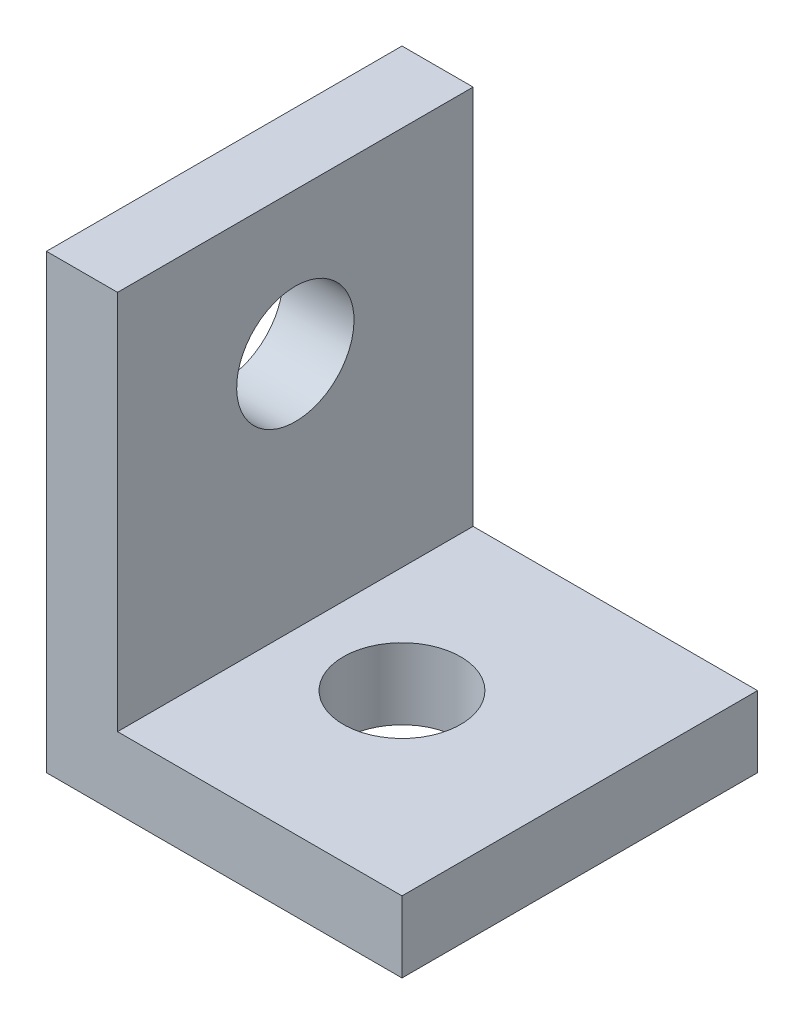
from build123d import *

# Parameters (mm, degrees)
BOSS_EXTRUDE1_DEPTH = 5
SKETCH2_R           = 1.65
CUT_EXTRUDE1_DEPTH  = 13.825365492
SKETCH3_R           = 1.65
CUT_EXTRUDE2_DEPTH  = 10


with BuildPart() as part:
    # Sketch1 → Boss-Extrude1 (new, symmetric)
    with BuildSketch(Plane.XY):
        Polygon((-5, 6.35), (-5, -6.35), (5, -6.35), (5, -4.35), (-3, -4.35), (-3, 6.35), align=None)
    extrude(amount=BOSS_EXTRUDE1_DEPTH, both=True)

    # Sketch2 → Cut-Extrude1 (cut, through all)
    with BuildSketch(Plane(origin=(0, -4.35, 0), x_dir=(1, 0, 0), z_dir=(0, 1, 0))):
        with Locations(Location((0, 0, 0), (0, 0, 180))):
            Circle(SKETCH2_R)
    extrude(amount=-CUT_EXTRUDE1_DEPTH, mode=Mode.SUBTRACT)

    # Sketch3 → Cut-Extrude2 (cut)
    with BuildSketch(Plane(origin=(-3, 0, 0), x_dir=(0, 0, -1), z_dir=(1, 0, 0))):
        with Locations(Location((0, 2.35, 0), (0, 0, 90))):
            Circle(SKETCH3_R)
    extrude(amount=-CUT_EXTRUDE2_DEPTH, mode=Mode.SUBTRACT)


solid = part.part
